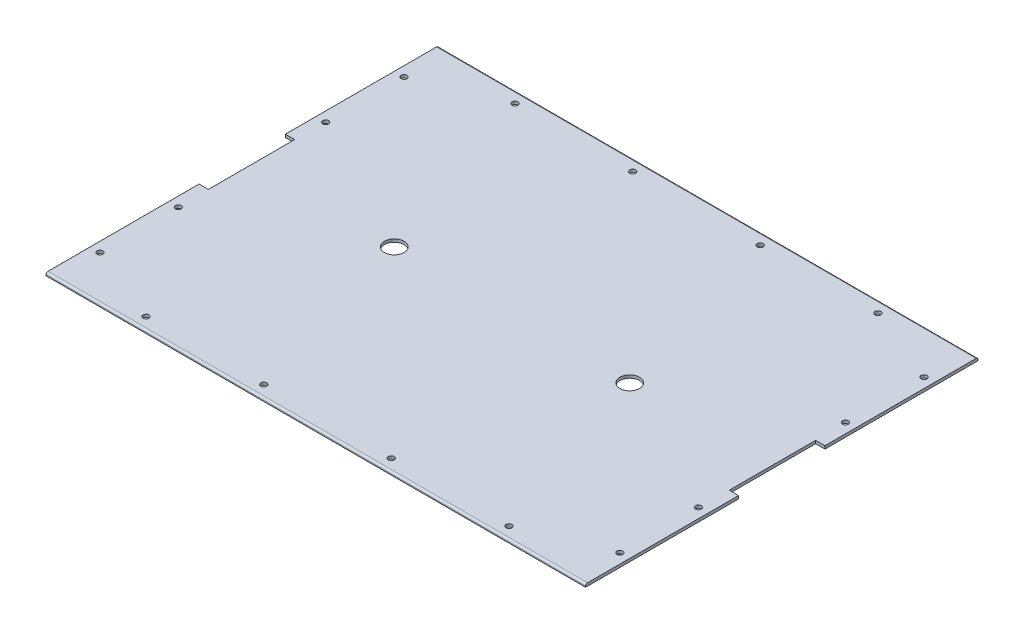
from build123d import *

# Parameters (mm, degrees)
SKETCH_1_R      = 3
SKETCH_1_R_2    = 10
EXTRUDE_1_DEPTH = 3
FILLET_1_R      = 2
FILLET_2_R      = 2


with BuildPart() as part:
    # 草图1 → 凸台-拉伸1 (new body)
    with BuildSketch(Plane(origin=(0, 0, 0), x_dir=(1, 0, 0), z_dir=(0, 1, 0))):
        Polygon((-275, -200), (275, -200), (275, -44), (265.5, -44), (265.5, 44), (275, 44), (275, 200), (-275, 200), (-275, 44), (-265.5, 44), (-265.5, -44), (-275, -44), align=None)
        with Locations(Location((-265, -75, 0), (0, 0, 270))):
            Circle(SKETCH_1_R, mode=Mode.SUBTRACT)
        with Locations(Location((-265, -155, 0), (0, 0, 270))):
            Circle(SKETCH_1_R, mode=Mode.SUBTRACT)
        with Locations(Location((-185, -188, 0), (0, 0, 270))):
            Circle(SKETCH_1_R, mode=Mode.SUBTRACT)
        with Locations(Location((-65, -188, 0), (0, 0, 270))):
            Circle(SKETCH_1_R, mode=Mode.SUBTRACT)
        with Locations(Location((-65, 188, 0), (0, 0, 270))):
            Circle(SKETCH_1_R, mode=Mode.SUBTRACT)
        with Locations(Location((-185, 188, 0), (0, 0, 270))):
            Circle(SKETCH_1_R, mode=Mode.SUBTRACT)
        with Locations(Location((-265, 155, 0), (0, 0, 270))):
            Circle(SKETCH_1_R, mode=Mode.SUBTRACT)
        with Locations(Location((-265, 75, 0), (0, 0, 270))):
            Circle(SKETCH_1_R, mode=Mode.SUBTRACT)
        with Locations(Location((265, 75, 0), (0, 0, 270))):
            Circle(SKETCH_1_R, mode=Mode.SUBTRACT)
        with Locations(Location((265, 155, 0), (0, 0, 270))):
            Circle(SKETCH_1_R, mode=Mode.SUBTRACT)
        with Locations(Location((185, 188, 0), (0, 0, 270))):
            Circle(SKETCH_1_R, mode=Mode.SUBTRACT)
        with Locations(Location((65, 188, 0), (0, 0, 270))):
            Circle(SKETCH_1_R, mode=Mode.SUBTRACT)
        with Locations(Location((65, -188, 0), (0, 0, 270))):
            Circle(SKETCH_1_R, mode=Mode.SUBTRACT)
        with Locations(Location((185, -188, 0), (0, 0, 270))):
            Circle(SKETCH_1_R, mode=Mode.SUBTRACT)
        with Locations(Location((265, -155, 0), (0, 0, 270))):
            Circle(SKETCH_1_R, mode=Mode.SUBTRACT)
        with Locations(Location((265, -75, 0), (0, 0, 270))):
            Circle(SKETCH_1_R, mode=Mode.SUBTRACT)
        with Locations(Location((-120, 0, 0), (0, 0, 270))):
            Circle(SKETCH_1_R_2, mode=Mode.SUBTRACT)
        with Locations(Location((120, 0, 0), (0, 0, 270))):
            Circle(SKETCH_1_R_2, mode=Mode.SUBTRACT)
    extrude(amount=EXTRUDE_1_DEPTH)

    # 圆角1
    fillet_1_edges = [part.edges().sort_by_distance(p)[0] for p in [
        (0, 3, 200),
    ]]
    fillet(fillet_1_edges, radius=FILLET_1_R)

    # 圆角2
    fillet_2_edges = [part.edges().sort_by_distance(p)[0] for p in [
        (0, 3, -200),
    ]]
    fillet(fillet_2_edges, radius=FILLET_2_R)


solid = part.part
